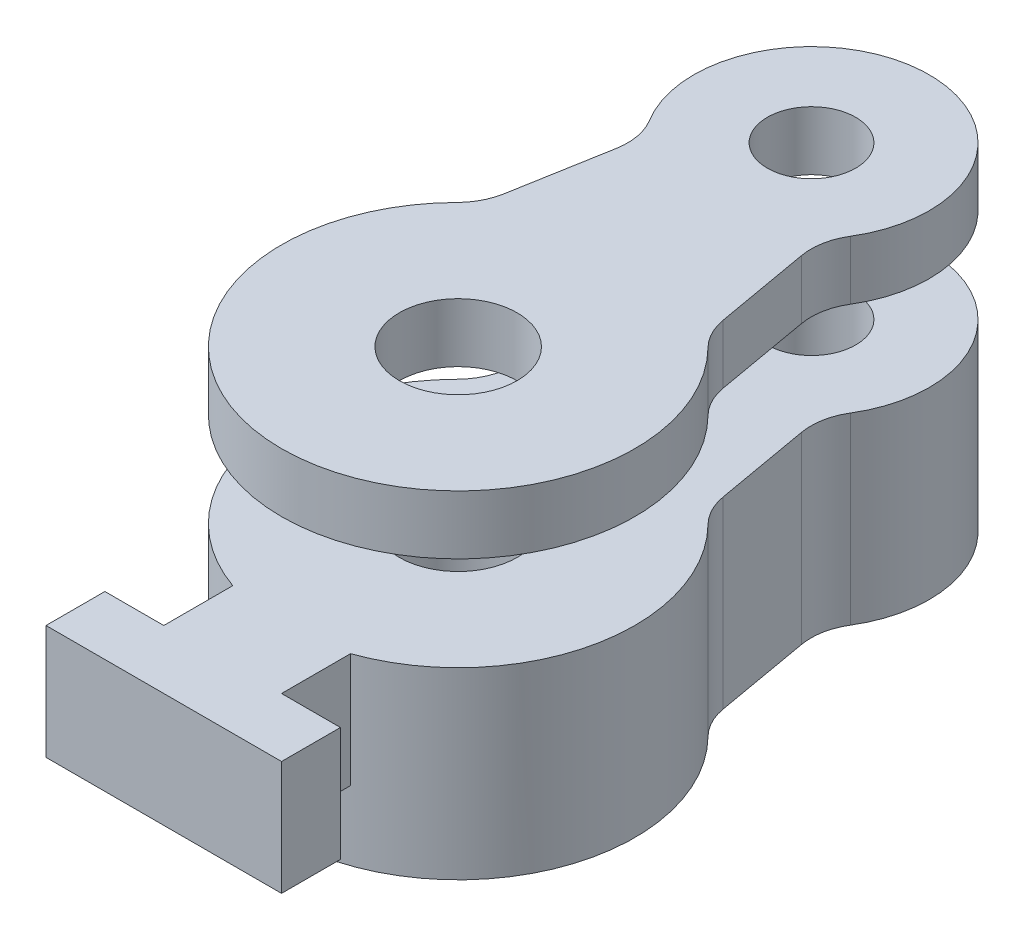
from build123d import *

# Parameters (mm, degrees)
SKETCH1_R           = 12.7
SKETCH1_R_2         = 9.525
BOSS_EXTRUDE1_DEPTH = 12.7
FILLET1_R           = 12.7
SKETCH3_R           = 9.525
SKETCH3_R_2         = 12.7
BOSS_EXTRUDE2_DEPTH = 39.624
BOSS_EXTRUDE3_START = -24.638
BOSS_EXTRUDE3_DEPTH = 24.638


with BuildPart() as part:
    # Sketch1 → Boss-Extrude1 (new body)
    with BuildSketch(Plane(origin=(0, 0, 0), x_dir=(1, 0, 0), z_dir=(0, 1, 0))):
        with BuildLine():
            Line((-24.35791626, 29.296790191), (-19.05, 59.399479175))
            ThreePointArc((-19.05, 59.399479175), (0, 101.6), (19.05, 59.399479175))
            Line((19.05, 59.399479175), (24.35791626, 29.296790191))
            ThreePointArc((24.35791626, 29.296790191), (0, -38.1), (-24.35791626, 29.296790191))
        make_face()
        with Locations(Location((0, 0, 0), (0, 0, 270))):
            Circle(SKETCH1_R, mode=Mode.SUBTRACT)
        with Locations(Location((0, 76.2, 0), (0, 0, 270))):
            Circle(SKETCH1_R_2, mode=Mode.SUBTRACT)
    extrude(amount=BOSS_EXTRUDE1_DEPTH)

    # Fillet1
    fillet1_edges = [part.edges().sort_by_distance(p)[0] for p in [
        (19.05, 6.35, -59.399479175),
        (24.35791626, 6.35, -29.296790191),
        (-24.35791626, 6.35, -29.296790191),
        (-19.05, 6.35, -59.399479175),
    ]]
    fillet(fillet1_edges, radius=FILLET1_R)


with BuildPart() as body_2:
    # Sketch3 → Boss-Extrude2 (new body)
    with BuildSketch(Plane(origin=(0, -20.32, 0), x_dir=(1, 0, 0), z_dir=(0, 1, 0))):
        with BuildLine():
            Line((23.614259759, 33.514275782), (19.984835556, 54.097763283))
            ThreePointArc((19.984835556, 54.097763283), (20.01439897, 58.669974371), (21.661262679, 62.935396759))
            ThreePointArc((21.661262679, 62.935396759), (0, 101.6), (-21.661262679, 62.935396759))
            ThreePointArc((-21.661262679, 62.935396759), (-20.01439897, 58.669974371), (-19.984835556, 54.097763283))
            Line((-19.984835556, 54.097763283), (-23.614259759, 33.514275782))
            ThreePointArc((-23.614259759, 33.514275782), (-24.839929511, 29.886917974), (-27.090988667, 26.789705729))
            ThreePointArc((-27.090988667, 26.789705729), (0, -38.1), (27.090988667, 26.789705729))
            ThreePointArc((27.090988667, 26.789705729), (24.839929511, 29.886917974), (23.614259759, 33.514275782))
        make_face()
        with Locations(Location((0, 76.2, 0), (0, 0, 270))):
            Circle(SKETCH3_R, mode=Mode.SUBTRACT)
        with Locations(Location((0, 0, 0), (0, 0, 270))):
            Circle(SKETCH3_R_2, mode=Mode.SUBTRACT)
    extrude(amount=-BOSS_EXTRUDE2_DEPTH)

    # Sketch4 → Boss-Extrude3 (add)
    with BuildSketch(Plane(origin=(0, -20.32, 0), x_dir=(1, 0, 0), z_dir=(0, 1, 0)).offset(BOSS_EXTRUDE3_START)):
        with BuildLine():
            Line((12.7, -50.8), (12.7, -35.921024484))
            ThreePointArc((12.7, -35.921024484), (0, -38.1), (-12.7, -35.921024484))
            Line((-12.7, -35.921024484), (-12.7, -50.8))
            Line((-12.7, -50.8), (-25.4, -50.8))
            Line((-25.4, -50.8), (-25.4, -63.5))
            Line((-25.4, -63.5), (25.4, -63.5))
            Line((25.4, -63.5), (25.4, -50.8))
            Line((25.4, -50.8), (12.7, -50.8))
        make_face()
    extrude(amount=BOSS_EXTRUDE3_DEPTH)


solid = Compound([part.part, body_2.part])
